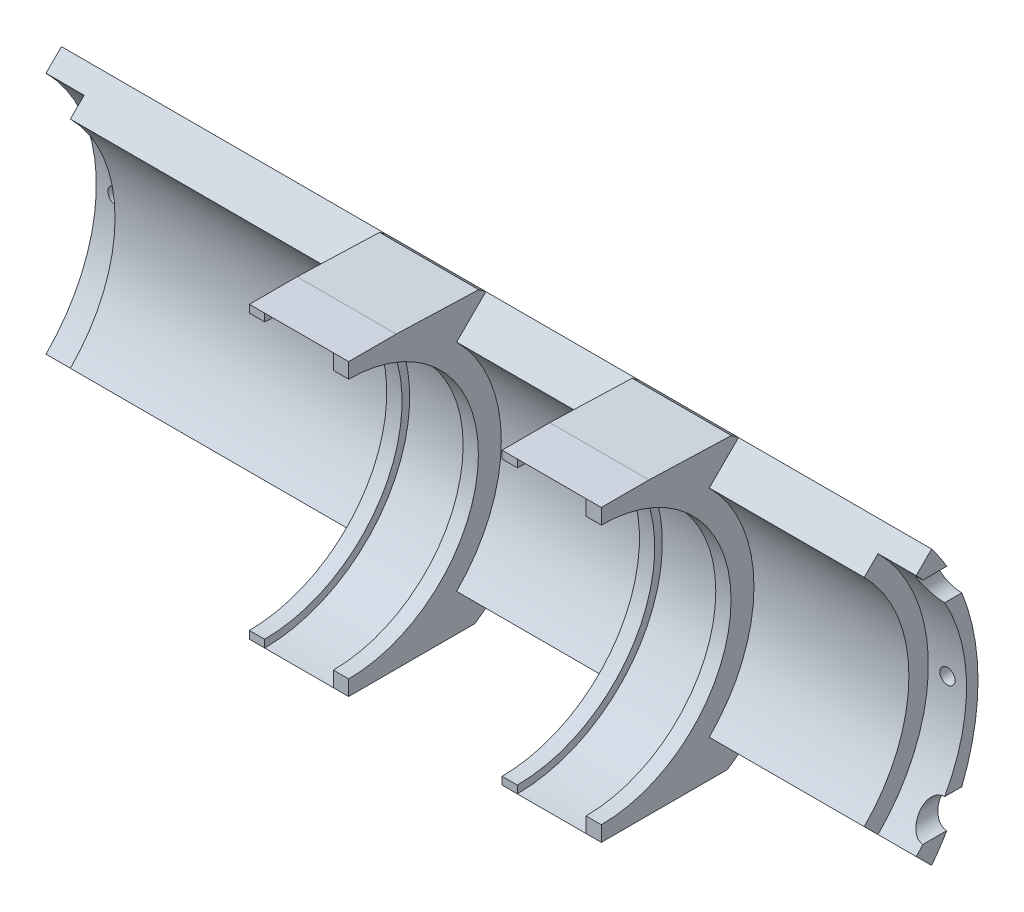
from build123d import *

# Parameters (mm, degrees)
BOSS_EXTRU_1_DEPTH           = 114
ESQUISSE2_R                  = 22.55
ENL_V_MAT_EXTRU_2_DEPTH      = 5
ENL_V_START                  = -5
ESQUISSE4_R                  = 22.55
ENL_V_MAT_EXTRU_3_DEPTH      = 5
ESQUISSE5_R                  = 1
ENL_V_MAT_EXTRU_4_DEPTH      = 118.883477756
BOSS_EXTRU_2_START           = -2
BOSS_EXTRU_2_DEPTH           = 2
BOSS_EXTRU_3_START           = 9
BOSS_EXTRU_3_DEPTH           = 9
BOSS_EXTRU_4_START           = 2
BOSS_EXTRU_4_DEPTH           = 2
BOSS_EXTRU_5_START           = -2
BOSS_EXTRU_5_DEPTH           = 2
BOSS_EXTRU_6_START           = 9
BOSS_EXTRU_6_DEPTH           = 9
BOSS_EXTRU_7_START           = 2
BOSS_EXTRU_7_DEPTH           = 2
ESQUISSE12_W                 = 13.751826503
ESQUISSE12_H                 = 1
ESQUISSE12_W_2               = 11.167500513
ENL_V_MAT_EXTRU_5_DEPTH      = 95.05366831
BOSS_EXTRU_8_START           = -13
BOSS_EXTRU_8_DEPTH           = 13
BOSS_EXTRU_9_START           = -13
BOSS_EXTRU_9_DEPTH           = 13
ENL_V_MAT_EXTRU_6_DEPTH      = 94.846110875
ENL_V_MAT_EXTRU_7_DEPTH      = 119.048305907
ENL_V_MAT_EXTRU_7_DEPTH_BACK = 119.048305907
ESQUISSE16_R                 = 2


with BuildPart() as part:
    # Esquisse1 → Boss.-Extru.1 (new body)
    with BuildSketch(Plane(origin=(0, 0, 0), x_dir=(0, 0, -1), z_dir=(1, 0, 0))):
        with BuildLine():
            Line((14.144270925, 14.14), (17.975320492, 17.947474134))
            ThreePointArc((17.975320492, 17.947474134), (24.05, 0), (17.975320492, -17.947474134))
            Line((17.975320492, -17.947474134), (14.144270925, -14.14))
            ThreePointArc((14.144270925, -14.14), (20, 0), (14.144270925, 14.14))
        make_face()
    extrude(amount=BOSS_EXTRU_1_DEPTH)

    # Esquisse2 → Enlèv. mat.-Extru.2 (cut)
    with BuildSketch(Plane.ZY):
        Circle(ESQUISSE2_R)
    extrude(amount=-ENL_V_MAT_EXTRU_2_DEPTH, mode=Mode.SUBTRACT)

    # Esquisse4 → Enlèv. mat.-Extru.3 (cut)
    with BuildSketch(Plane(origin=(114, 0, 0), x_dir=(0, 0, -1), z_dir=(1, 0, 0)).offset(ENL_V_START)):
        Circle(ESQUISSE4_R)
    extrude(amount=ENL_V_MAT_EXTRU_3_DEPTH, mode=Mode.SUBTRACT)

    # Esquisse5 → Enlèv. mat.-Extru.4 (cut, through all)
    with BuildSketch(Plane.XY):
        with Locations((2.5, 0)):
            Circle(ESQUISSE5_R)
        with Locations((111.5, 0)):
            Circle(ESQUISSE5_R)
    extrude(amount=-ENL_V_MAT_EXTRU_4_DEPTH, mode=Mode.SUBTRACT)

    # Esquisse6 → Boss.-Extru.2 (add)
    with BuildSketch(Plane(origin=(88.7, 0, 0), x_dir=(0, 0, -1), z_dir=(1, 0, 0)).offset(BOSS_EXTRU_2_START)):
        with BuildLine():
            Line((0, 17), (0, 20))
            ThreePointArc((0, 20), (20, 0), (0, -20))
            Line((0, -20), (0, -17))
            ThreePointArc((0, -17), (17, 0), (0, 17))
        make_face()
    extrude(amount=BOSS_EXTRU_2_DEPTH)

    # Esquisse7 → Boss.-Extru.3 (add)
    with BuildSketch(Plane.ZY.offset(-86.7).offset(BOSS_EXTRU_3_START)):
        with BuildLine():
            Line((0, 20), (0, 19))
            ThreePointArc((0, 19), (-19, 0), (0, -19))
            Line((0, -19), (0, -20))
            ThreePointArc((0, -20), (-20, 0), (0, 20))
        make_face()
    extrude(amount=-BOSS_EXTRU_3_DEPTH)

    # Esquisse8 → Boss.-Extru.4 (add)
    with BuildSketch(Plane.ZY.offset(-77.7).offset(BOSS_EXTRU_4_START)):
        with BuildLine():
            Line((0, 20), (0, 18))
            ThreePointArc((0, 18), (-18, 0), (0, -18))
            Line((0, -18), (0, -20))
            ThreePointArc((0, -20), (-20, 0), (0, 20))
        make_face()
    extrude(amount=-BOSS_EXTRU_4_DEPTH)

    # Esquisse9 → Boss.-Extru.5 (add)
    with BuildSketch(Plane(origin=(55.6, 0, 0), x_dir=(0, 0, -1), z_dir=(1, 0, 0)).offset(BOSS_EXTRU_5_START)):
        with BuildLine():
            Line((0, 20), (0, 17))
            ThreePointArc((0, 17), (17, 0), (0, -17))
            Line((0, -17), (0, -20))
            ThreePointArc((0, -20), (20, 0), (0, 20))
        make_face()
    extrude(amount=BOSS_EXTRU_5_DEPTH)

    # Esquisse10 → Boss.-Extru.6 (add)
    with BuildSketch(Plane.ZY.offset(-53.6).offset(BOSS_EXTRU_6_START)):
        with BuildLine():
            Line((0, 20), (0, 19))
            ThreePointArc((0, 19), (-19, 0), (0, -19))
            Line((0, -19), (0, -20))
            ThreePointArc((0, -20), (-20, 0), (0, 20))
        make_face()
    extrude(amount=-BOSS_EXTRU_6_DEPTH)

    # Esquisse11 → Boss.-Extru.7 (add)
    with BuildSketch(Plane.ZY.offset(-44.6).offset(BOSS_EXTRU_7_START)):
        with BuildLine():
            Line((0, 20), (0, 18))
            ThreePointArc((0, 18), (-18, 0), (0, -18))
            Line((0, -18), (0, -20))
            ThreePointArc((0, -20), (-20, 0), (0, 20))
        make_face()
    extrude(amount=-BOSS_EXTRU_7_DEPTH)

    # Esquisse12 → Enlèv. mat.-Extru.5 (cut, through all)
    with BuildSketch(Plane(origin=(88.7, 0, 0), x_dir=(0, 0, -1), z_dir=(1, 0, 0))):
        with Locations((6.875913252, -19.5)):
            Rectangle(ESQUISSE12_W, ESQUISSE12_H)
        with Locations((5.583750257, 19.5)):
            Rectangle(ESQUISSE12_W_2, ESQUISSE12_H)
    extrude(amount=-ENL_V_MAT_EXTRU_5_DEPTH, mode=Mode.SUBTRACT)

    # Esquisse13 → Boss.-Extru.8 (add)
    with BuildSketch(Plane(origin=(88.7, 0, 0), x_dir=(0, 0, -1), z_dir=(1, 0, 0)).offset(BOSS_EXTRU_8_START)):
        with BuildLine():
            Line((17.975320492, 17.947474134), (14.144270925, 14.14))
            ThreePointArc((14.144270925, 14.14), (10.480241973, 17.034216395), (6.244997998, 19))
            Line((6.244997998, 19), (17.4396757, 18.627232183))
            ThreePointArc((17.4396757, 18.627232183), (17.709986765, 18.289314213), (17.975320492, 17.947474134))
        make_face()
        with BuildLine():
            Line((14.144270925, -14.14), (17.975320492, -17.947474134))
            ThreePointArc((17.975320492, -17.947474134), (17.559611782, -18.478549847), (17.131891216, -19))
            Line((17.131891216, -19), (6.244997998, -19))
            ThreePointArc((6.244997998, -19), (10.480241973, -17.034216395), (14.144270925, -14.14))
        make_face()
    extrude(amount=BOSS_EXTRU_8_DEPTH)

    # Esquisse14 → Boss.-Extru.9 (add)
    with BuildSketch(Plane(origin=(55.6, 0, 0), x_dir=(0, 0, -1), z_dir=(1, 0, 0)).offset(BOSS_EXTRU_9_START)):
        with BuildLine():
            Line((14.144270925, 14.14), (17.975320492, 17.947474134))
            ThreePointArc((17.975320492, 17.947474134), (17.709986765, 18.289314213), (17.4396757, 18.627232183))
            Line((17.4396757, 18.627232183), (6.244997998, 19))
            ThreePointArc((6.244997998, 19), (10.480241973, 17.034216395), (14.144270925, 14.14))
        make_face()
        with BuildLine():
            Line((14.144270925, -14.14), (17.975320492, -17.947474134))
            ThreePointArc((17.975320492, -17.947474134), (17.559611782, -18.478549847), (17.131891216, -19))
            Line((17.131891216, -19), (6.244997998, -19))
            ThreePointArc((6.244997998, -19), (10.480241973, -17.034216395), (14.144270925, -14.14))
        make_face()
    extrude(amount=BOSS_EXTRU_9_DEPTH)

    # Esquisse15 → Enlèv. mat.-Extru.6 (cut, through all)
    with BuildSketch(Plane(origin=(88.7, 0, 0), x_dir=(0, 0, -1), z_dir=(1, 0, 0))):
        with BuildLine():
            Line((14.409304815, 20.298729325), (16.901493379, 24.760797344))
            Line((16.901493379, 24.760797344), (24.890475951, 20.298729325))
            Line((24.890475951, 20.298729325), (20.895984665, 15.394026057))
            ThreePointArc((20.895984665, 15.394026057), (17.822174246, 18.070587713), (14.409304815, 20.298729325))
        make_face()
        with BuildLine():
            Line((14.409304815, -20.298729325), (16.901493379, -24.760797344))
            Line((16.901493379, -24.760797344), (22.934233847, -18.464332541))
            Line((22.934233847, -18.464332541), (20.431131458, -15.848802481))
            ThreePointArc((20.431131458, -15.848802481), (17.561732891, -18.265269573), (14.409304815, -20.298729325))
        make_face()
    extrude(amount=-ENL_V_MAT_EXTRU_6_DEPTH, mode=Mode.SUBTRACT)

    # Esquisse16 → Enlèv. mat.-Extru.7 (cut, two sides: drawn at the far end of the back side and taken through both)
    with BuildSketch(Plane.XY.offset(-ENL_V_MAT_EXTRU_7_DEPTH_BACK)):
        with Locations((114, 13)):
            Circle(ESQUISSE16_R)
        with Locations((114, -13)):
            Circle(ESQUISSE16_R)
    extrude(amount=ENL_V_MAT_EXTRU_7_DEPTH + ENL_V_MAT_EXTRU_7_DEPTH_BACK, mode=Mode.SUBTRACT)


solid = part.part
